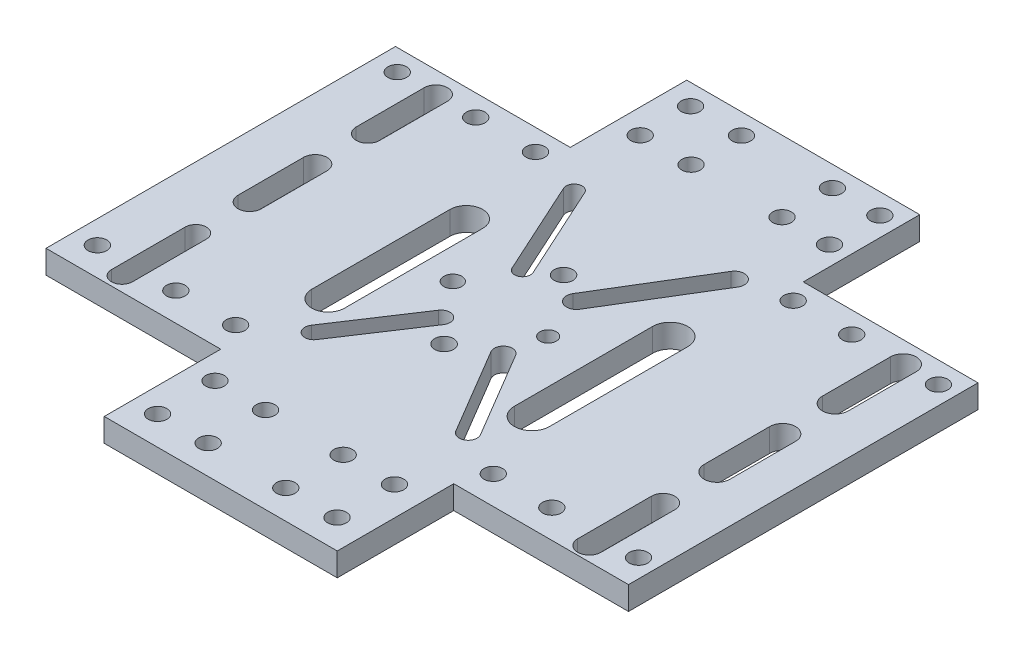
from build123d import *

# Parameters (mm, degrees)
SKETCH_1_R      = 3.519137415
SKETCH_1_R_2    = 4.021871331
SKETCH_1_R_3    = 4.053170413
SKETCH_1_R_4    = 3.845688718
SKETCH_1_R_5    = 4
EXTRUDE_1_DEPTH = 10


with BuildPart() as part:
    # 草图1 → 凸台-拉伸1 (new body)
    with BuildSketch(Plane(origin=(0, 0, 0), x_dir=(1, 0, 0), z_dir=(0, 1, 0))):
        Polygon((0, -50), (75, -50), (75, 0), (175, 0), (175, -50), (250, -50), (250, -200), (175, -200), (175, -250), (75, -250), (75, -200), (0, -200), align=None)
        with Locations(Location((140.533556543, -125.014564911, 0), (0, 0, 270))):
            Circle(SKETCH_1_R, mode=Mode.SUBTRACT)
        with Locations(Location((121.008156214, -98.872401259, 0), (0, 0, 270))):
            Circle(SKETCH_1_R_2, mode=Mode.SUBTRACT)
        with Locations(Location((121.008156214, -150.151260731, 0), (0, 0, 270))):
            Circle(SKETCH_1_R_3, mode=Mode.SUBTRACT)
        with Locations(Location((99.599362347, -125.014564911, 0), (0, 0, 270))):
            Circle(SKETCH_1_R_4, mode=Mode.SUBTRACT)
        with Locations(Location((85.515139111, -8.883030225, 0), (0, 0, 270))):
            Circle(SKETCH_1_R_5, mode=Mode.SUBTRACT)
        with Locations(Location((85.515139111, -30.50058863, 0), (0, 0, 270))):
            Circle(SKETCH_1_R_5, mode=Mode.SUBTRACT)
        with Locations(Location((107.349135631, -8.883030225, 0), (0, 0, 270))):
            Circle(SKETCH_1_R_5, mode=Mode.SUBTRACT)
        with Locations(Location((107.349135631, -30.50058863, 0), (0, 0, 270))):
            Circle(SKETCH_1_R_5, mode=Mode.SUBTRACT)
        with Locations(Location((146.396218991, -8.883030225, 0), (0, 0, 270))):
            Circle(SKETCH_1_R_5, mode=Mode.SUBTRACT)
        with Locations(Location((166.756942605, -8.883030225, 0), (0, 0, 270))):
            Circle(SKETCH_1_R_5, mode=Mode.SUBTRACT)
        with Locations(Location((146.396218991, -30.50058863, 0), (0, 0, 270))):
            Circle(SKETCH_1_R_5, mode=Mode.SUBTRACT)
        with Locations(Location((166.756942605, -30.50058863, 0), (0, 0, 270))):
            Circle(SKETCH_1_R_5, mode=Mode.SUBTRACT)
        with Locations(Location((85.515139111, -237.626962183, 0), (0, 0, 270))):
            Circle(SKETCH_1_R_5, mode=Mode.SUBTRACT)
        with Locations(Location((85.515139111, -212.99300028, 0), (0, 0, 270))):
            Circle(SKETCH_1_R_5, mode=Mode.SUBTRACT)
        with Locations(Location((107.217902356, -212.99300028, 0), (0, 0, 270))):
            Circle(SKETCH_1_R_5, mode=Mode.SUBTRACT)
        with Locations(Location((107.217902356, -237.626962183, 0), (0, 0, 270))):
            Circle(SKETCH_1_R_5, mode=Mode.SUBTRACT)
        with Locations(Location((162.537022604, -212.99300028, 0), (0, 0, 270))):
            Circle(SKETCH_1_R_5, mode=Mode.SUBTRACT)
        with Locations(Location((162.537022604, -237.626962183, 0), (0, 0, 270))):
            Circle(SKETCH_1_R_5, mode=Mode.SUBTRACT)
        with Locations(Location((140.533556543, -212.99300028, 0), (0, 0, 270))):
            Circle(SKETCH_1_R_5, mode=Mode.SUBTRACT)
        with Locations(Location((140.533556543, -237.626962183, 0), (0, 0, 270))):
            Circle(SKETCH_1_R_5, mode=Mode.SUBTRACT)
        with Locations(Location((9.903960691, -59.156421864, 0), (0, 0, 270))):
            Circle(SKETCH_1_R_5, mode=Mode.SUBTRACT)
        with Locations(Location((242.167030064, -59.156421864, 0), (0, 0, 270))):
            Circle(SKETCH_1_R_5, mode=Mode.SUBTRACT)
        with Locations(Location((242.167030064, -187.85630446, 0), (0, 0, 270))):
            Circle(SKETCH_1_R_5, mode=Mode.SUBTRACT)
        with Locations(Location((204.964720251, -59.156421864, 0), (0, 0, 270))):
            Circle(SKETCH_1_R_5, mode=Mode.SUBTRACT)
        with Locations(Location((204.964720251, -187.85630446, 0), (0, 0, 270))):
            Circle(SKETCH_1_R_5, mode=Mode.SUBTRACT)
        with Locations(Location((9.903960691, -187.85630446, 0), (0, 0, 270))):
            Circle(SKETCH_1_R_5, mode=Mode.SUBTRACT)
        with Locations(Location((43.587133089, -59.156421864, 0), (0, 0, 270))):
            Circle(SKETCH_1_R_5, mode=Mode.SUBTRACT)
        with Locations(Location((43.587133089, -187.85630446, 0), (0, 0, 270))):
            Circle(SKETCH_1_R_5, mode=Mode.SUBTRACT)
        with Locations(Location((69.226562825, -59.156421864, 0), (0, 0, 270))):
            Circle(SKETCH_1_R_5, mode=Mode.SUBTRACT)
        with Locations(Location((69.226562825, -187.85630446, 0), (0, 0, 270))):
            Circle(SKETCH_1_R_5, mode=Mode.SUBTRACT)
        with Locations(Location((179.828024432, -59.156421864, 0), (0, 0, 270))):
            Circle(SKETCH_1_R_5, mode=Mode.SUBTRACT)
        with Locations(Location((179.828024432, -187.85630446, 0), (0, 0, 270))):
            Circle(SKETCH_1_R_5, mode=Mode.SUBTRACT)
        with BuildLine():
            Line((31.521519096, -110.938015252), (31.521519096, -139.09111457))
            ThreePointArc((31.521519096, -139.09111457), (26.494179932, -144.118453734), (21.466840768, -139.09111457))
            Line((21.466840768, -139.09111457), (21.466840768, -110.938015252))
            ThreePointArc((21.466840768, -110.938015252), (26.494179932, -105.910676088), (31.521519096, -110.938015252))
        make_face(mode=Mode.SUBTRACT)
        with BuildLine():
            Line((31.521519096, -59.156421864), (31.521519096, -88.314989015))
            ThreePointArc((31.521519096, -88.314989015), (26.494179932, -93.342328179), (21.466840768, -88.314989015))
            Line((21.466840768, -88.314989015), (21.466840768, -59.156421864))
            ThreePointArc((21.466840768, -59.156421864), (26.494179932, -54.1290827), (31.521519096, -59.156421864))
        make_face(mode=Mode.SUBTRACT)
        with BuildLine():
            Line((21.969574685, -193.889111457), (21.969574685, -162.216874724))
            ThreePointArc((21.969574685, -162.216874724), (26.494179932, -157.692269477), (31.01878518, -162.216874724))
            Line((31.01878518, -162.216874724), (31.01878518, -193.889111457))
            ThreePointArc((31.01878518, -193.889111457), (26.494179932, -198.413716704), (21.969574685, -193.889111457))
        make_face(mode=Mode.SUBTRACT)
        with BuildLine():
            Line((232.615085653, -59.156421864), (232.615085653, -88.314989015))
            ThreePointArc((232.615085653, -88.314989015), (227.085012572, -93.845062095), (221.554939492, -88.314989015))
            Line((221.554939492, -88.314989015), (221.554939492, -59.156421864))
            ThreePointArc((221.554939492, -59.156421864), (227.085012572, -53.626348784), (232.615085653, -59.156421864))
        make_face(mode=Mode.SUBTRACT)
        with BuildLine():
            Line((232.615085653, -110.938015252), (232.615085653, -139.09111457))
            ThreePointArc((232.615085653, -139.09111457), (227.085012572, -144.621187651), (221.554939492, -139.09111457))
            Line((221.554939492, -139.09111457), (221.554939492, -110.938015252))
            ThreePointArc((221.554939492, -110.938015252), (227.085012572, -105.407942172), (232.615085653, -110.938015252))
        make_face(mode=Mode.SUBTRACT)
        with BuildLine():
            Line((232.112351736, -162.216874724), (232.112351736, -193.889111457))
            ThreePointArc((232.112351736, -193.889111457), (227.085012572, -198.916450621), (222.057673408, -193.889111457))
            Line((222.057673408, -193.889111457), (222.057673408, -162.216874724))
            ThreePointArc((222.057673408, -162.216874724), (227.085012572, -157.18953556), (232.112351736, -162.216874724))
        make_face(mode=Mode.SUBTRACT)
        with BuildLine():
            Line((86.319515983, -98.872401259), (86.319515983, -158.195003393))
            ThreePointArc((86.319515983, -158.195003393), (79.281241153, -165.233278223), (72.242966324, -158.195003393))
            Line((72.242966324, -158.195003393), (72.242966324, -98.872401259))
            ThreePointArc((72.242966324, -98.872401259), (79.281241153, -91.834126429), (86.319515983, -98.872401259))
        make_face(mode=Mode.SUBTRACT)
        with BuildLine():
            Line((174.297951351, -98.872401259), (174.297951351, -158.195003393))
            ThreePointArc((174.297951351, -158.195003393), (166.756942605, -165.736012139), (159.215933859, -158.195003393))
            Line((159.215933859, -158.195003393), (159.215933859, -98.872401259))
            ThreePointArc((159.215933859, -98.872401259), (166.756942605, -91.331392513), (174.297951351, -98.872401259))
        make_face(mode=Mode.SUBTRACT)
        with BuildLine():
            Line((94.951197402, -63.772444805), (113.552352308, -104.493892032))
            ThreePointArc((113.552352308, -104.493892032), (111.867528025, -109.012284427), (107.349135631, -107.327460144))
            Line((107.349135631, -107.327460144), (88.747980724, -66.606012917))
            ThreePointArc((88.747980724, -66.606012917), (90.432805007, -62.087620522), (94.951197402, -63.772444805))
        make_face(mode=Mode.SUBTRACT)
        with BuildLine():
            Line((162.851897535, -65.984783395), (137.212467799, -108.123014678))
            ThreePointArc((137.212467799, -108.123014678), (131.364165534, -109.546639764), (129.940540448, -103.698337499))
            Line((129.940540448, -103.698337499), (155.579970184, -61.560106215))
            ThreePointArc((155.579970184, -61.560106215), (161.428272449, -60.136481129), (162.851897535, -65.984783395))
        make_face(mode=Mode.SUBTRACT)
        with BuildLine():
            Line((85.515139111, -171.644415429), (107.217902356, -138.787064009))
            ThreePointArc((107.217902356, -138.787064009), (112.586083341, -137.689561768), (113.683585583, -143.057742753))
            Line((113.683585583, -143.057742753), (91.980822338, -175.915094173))
            ThreePointArc((91.980822338, -175.915094173), (86.612641352, -177.012596415), (85.515139111, -171.644415429))
        make_face(mode=Mode.SUBTRACT)
        with BuildLine():
            Line((140.533556543, -138.95433705), (162.537022604, -176.084926759))
            ThreePointArc((162.537022604, -176.084926759), (161.184000191, -181.374081835), (155.894845115, -180.021059422))
            Line((155.894845115, -180.021059422), (133.891379055, -142.890469712))
            ThreePointArc((133.891379055, -142.890469712), (135.244401467, -137.601314637), (140.533556543, -138.95433705))
        make_face(mode=Mode.SUBTRACT)
    extrude(amount=EXTRUDE_1_DEPTH)


solid = part.part
